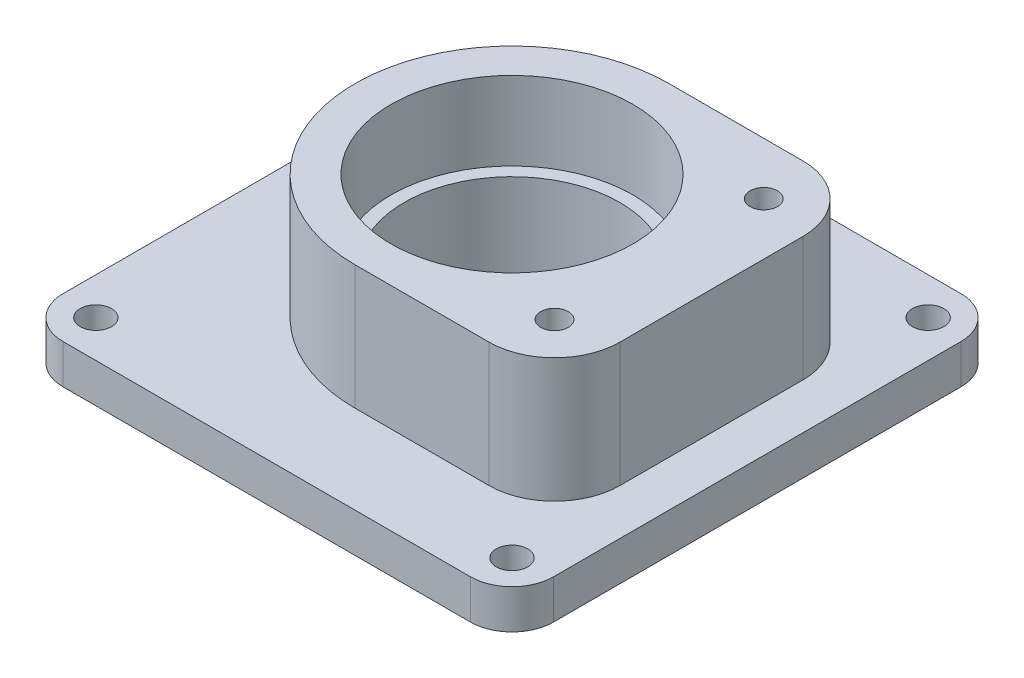
from build123d import *

# Parameters (mm, degrees)
SKETCH2_W                = 75
SKETCH2_H                = 75
SKETCH2_R                = 21
BOSS_EXTRUDE1_DEPTH      = 6
M4_CLEARANCE_HOLE1_D     = 4.8
M4_CLEARANCE_HOLE1_DEPTH = 25
FILLET1_R                = 6.35
SKETCH5_R                = 22.809118079
BOSS_EXTRUDE2_DEPTH      = 19
FILLET2_R                = 10
M5_TAPPED_HOLE1_D        = 4.2
M5_TAPPED_HOLE1_DEPTH    = 12.4
M5_TAPPED_HOLE1_TIP      = 1.2618073


with BuildPart() as part:
    # Sketch1 → Revolve1 (revolve)
    with BuildSketch(Plane.XY, mode=Mode.PRIVATE) as revolve1_sk:
        Polygon((-16.5, 0), (-34, 0), (-34, 6), (-24, 6), (-24, 25), (-18.5, 25), (-18.5, 13), (-16.5, 13), align=None)
    revolve(revolve1_sk.sketch.rotate(Axis((0, 0, 0), (0, 1, 0)), 270), axis=Axis((0, 0, 0), (0, 1, 0)))

    # Sketch2 → Boss-Extrude1 (add)
    with BuildSketch(Plane(origin=(0, 6, 0), x_dir=(1, 0, 0), z_dir=(0, 1, 0))):
        Rectangle(SKETCH2_W, SKETCH2_H)
        Circle(SKETCH2_R, mode=Mode.SUBTRACT)
    extrude(amount=-BOSS_EXTRUDE1_DEPTH)

    # M4 Clearance Hole1
    with Locations(Plane(origin=(0, 0, 0), x_dir=(-1, 0, 0), z_dir=(0, -1, 0))):
        with Locations((0, 0), (-31.819805153, 31.819805153), (31.819805153, 31.819805153), (31.819805153, -31.819805153), (-31.819805153, -31.819805153)):
            Hole(M4_CLEARANCE_HOLE1_D / 2, depth=M4_CLEARANCE_HOLE1_DEPTH)

    # Fillet1
    fillet1_edges = [part.edges().sort_by_distance(p)[0] for p in [
        (37.5, 3, 37.5),
        (37.5, 3, -37.5),
        (-37.5, 3, -37.5),
        (-37.5, 3, 37.5),
    ]]
    fillet(fillet1_edges, radius=FILLET1_R)

    # Sketch5 → Boss-Extrude2 (add)
    with BuildSketch(Plane(origin=(0, 25, 0), x_dir=(1, 0, 0), z_dir=(0, 1, 0))):
        with BuildLine():
            Line((0, 24), (6.5, 24))
            Line((6.5, 24), (30.5, 24))
            Line((30.5, 24), (30.5, -24))
            Line((30.5, -24), (6.5, -24))
            Line((6.5, -24), (0, -24))
            ThreePointArc((0, -24), (-24, 0), (0, 24))
        make_face()
        Circle(SKETCH5_R, mode=Mode.SUBTRACT)
    extrude(amount=-BOSS_EXTRUDE2_DEPTH)

    # Fillet2
    fillet2_edges = [part.edges().sort_by_distance(p)[0] for p in [
        (30.5, 15.5, -24),
        (30.5, 15.5, 24),
    ]]
    fillet(fillet2_edges, radius=FILLET2_R)

    # M5 Tapped Hole1
    with Locations(Plane(origin=(0, 25, 0), x_dir=(1, 0, 0), z_dir=(0, 1, 0))):
        with Locations((22.5, 16), (22.5, -16)):
            Hole(M5_TAPPED_HOLE1_D / 2, depth=M5_TAPPED_HOLE1_DEPTH)
            with Locations((0, 0, -(M5_TAPPED_HOLE1_DEPTH + M5_TAPPED_HOLE1_TIP / 2))):  # 118° drill point
                Cone(0, M5_TAPPED_HOLE1_D / 2, M5_TAPPED_HOLE1_TIP, mode=Mode.SUBTRACT)


solid = part.part
